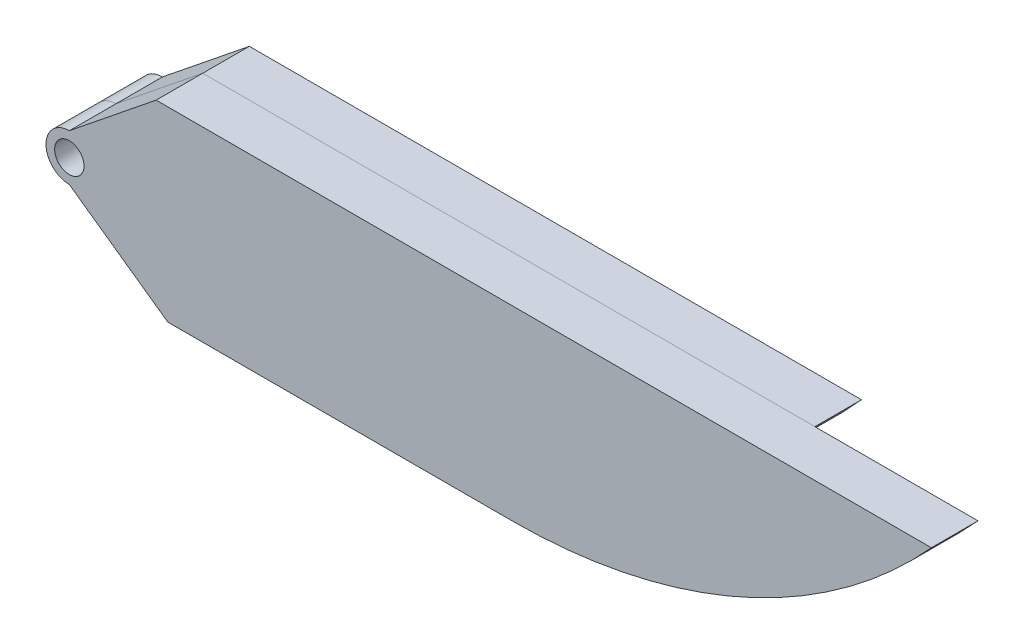
from build123d import *

# Parameters (mm, degrees)
SKETCH1_W           = 203.2
SKETCH1_H           = 50.8
BOSS_EXTRUDE1_DEPTH = 12.7
SKETCH3_R           = 4
CUT_EXTRUDE1_DEPTH  = 106.494123059
CUT_EXTRUDE2_DEPTH  = 106.494123059
BOSS_EXTRUDE4_DEPTH = 12.7
CUT_EXTRUDE4_START  = 12.7
SKETCH11_5_R        = 4
CUT_EXTRUDE4_DEPTH  = 12.7


with BuildPart() as part:
    # Sketch1 → Boss-Extrude1 (new body)
    with BuildSketch(Plane.XY):
        Rectangle(SKETCH1_W, SKETCH1_H)
    extrude(amount=BOSS_EXTRUDE1_DEPTH)

    # Sketch3 → Cut-Extrude1 (cut, through all)
    with BuildSketch(Plane.XY.offset(12.7)):
        with Locations((-88.9, 0)):
            Circle(SKETCH3_R)
    extrude(amount=-CUT_EXTRUDE1_DEPTH, mode=Mode.SUBTRACT)

    # Sketch5 → Cut-Extrude2 (cut, through all)
    with BuildSketch(Plane.XY.offset(12.7)):
        with BuildLine():
            Line((-88.9, -6.35), (-62.046109456, -25.4))
            Line((-62.046109456, -25.4), (-101.6, -25.4))
            Line((-101.6, -25.4), (-101.6, 25.4))
            Line((-101.6, 25.4), (-65.239311186, 25.4))
            Line((-65.239311186, 25.4), (-88.9, 6.35))
            ThreePointArc((-88.9, 6.35), (-95.25, 0), (-88.9, -6.35))
        make_face()
        with BuildLine():
            Line((101.6, 25.4), (101.6, -25.4))
            Line((101.6, -25.4), (0, -25.4))
            ThreePointArc((0, -25.4), (55.709861996, -9.819723993), (101.6, 25.4))
        make_face()
    extrude(amount=-CUT_EXTRUDE2_DEPTH, mode=Mode.SUBTRACT)


with BuildPart() as body_2:
    # Sketch11 → Boss-Extrude4 (new body)
    with BuildSketch(Plane.XY.offset(12.7)):
        with BuildLine():
            Line((-65.239311186, 25.4), (-88.9, 6.35))
            ThreePointArc((-88.9, 6.35), (-95.25, 0), (-88.9, -6.35))
            Line((-88.9, -6.35), (-62.046109456, -25.4))
            Line((-62.046109456, -25.4), (0, -25.4))
            Line((0, -25.4), (31.75, -25.4))
            ThreePointArc((31.75, -25.4), (94.290247041, -12.128055843), (146.05, 25.4))
            Line((146.05, 25.4), (101.6, 25.4))
            Line((101.6, 25.4), (-65.239311186, 25.4))
        make_face()
    extrude(amount=BOSS_EXTRUDE4_DEPTH)

    # Sketch11<5> → Cut-Extrude4 (cut)
    with BuildSketch(Plane.XY.offset(12.7).offset(CUT_EXTRUDE4_START)):
        with Locations((-88.9, 0)):
            Circle(SKETCH11_5_R)
    extrude(amount=-CUT_EXTRUDE4_DEPTH, mode=Mode.SUBTRACT)


solid = Compound([part.part, body_2.part])
